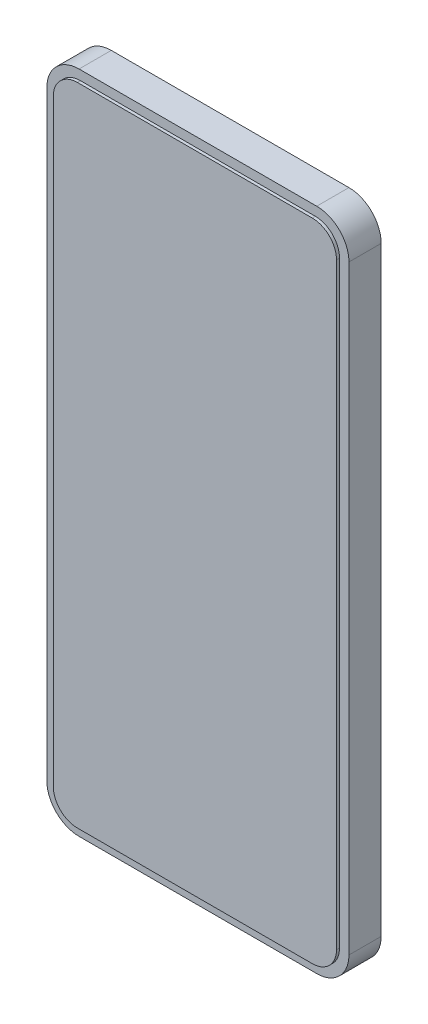
from build123d import *

# Parameters (mm, degrees)
SKETCH1_W           = 75
SKETCH1_H           = 165
BOSS_EXTRUDE1_DEPTH = 8
FILLET1_R           = 8
SKETCH2_W           = 22
SKETCH2_H           = 35
BOSS_EXTRUDE2_DEPTH = 1
FILLET2_R           = 6
SKETCH3_R           = 5
SKETCH3_R_2         = 4
SKETCH3_R_3         = 1.859320818
CUT_EXTRUDE1_DEPTH  = 0.5
SKETCH4_W           = 70.313708498
SKETCH4_H           = 160.313708498
BOSS_EXTRUDE3_DEPTH = 0.75
FILLET3_R           = 6


with BuildPart() as part:
    # Sketch1 → Boss-Extrude1 (new body)
    with BuildSketch(Plane.XY):
        Rectangle(SKETCH1_W, SKETCH1_H)
    extrude(amount=BOSS_EXTRUDE1_DEPTH)

    # Fillet1
    fillet1_edges = [part.edges().sort_by_distance(p)[0] for p in [
        (37.5, -82.5, 4),
        (-37.5, -82.5, 4),
        (-37.5, 82.5, 4),
        (37.5, 82.5, 4),
    ]]
    fillet(fillet1_edges, radius=FILLET1_R)

    # Sketch2 → Boss-Extrude2 (add)
    with BuildSketch(Plane(origin=(0, 0, 0), x_dir=(-1, 0, 0), z_dir=(0, 0, -1))):
        with Locations((-19.5, 58)):
            Rectangle(SKETCH2_W, SKETCH2_H)
    extrude(amount=BOSS_EXTRUDE2_DEPTH)

    # Fillet2
    fillet2_edges = [part.edges().sort_by_distance(p)[0] for p in [
        (8.5, 40.5, -0.5),
        (8.5, 75.5, -0.5),
        (30.5, 75.5, -0.5),
        (30.5, 40.5, -0.5),
    ]]
    fillet(fillet2_edges, radius=FILLET2_R)

    # Sketch3 → Cut-Extrude1 (cut)
    with BuildSketch(Plane(origin=(0, 0, -1), x_dir=(-1, 0, 0), z_dir=(0, 0, -1))):
        with Locations((-23.043680303, 68)):
            Circle(SKETCH3_R)
        with Locations((-23.043680303, 57)):
            Circle(SKETCH3_R_2)
        with Locations((-23.043680303, 47)):
            Circle(SKETCH3_R_2)
        with Locations((-13.043680303, 68)):
            Circle(SKETCH3_R_3)
    extrude(amount=-CUT_EXTRUDE1_DEPTH, mode=Mode.SUBTRACT)

    # Sketch4 → Boss-Extrude3 (add)
    with BuildSketch(Plane.XY.offset(8)):
        Rectangle(SKETCH4_W, SKETCH4_H)
    extrude(amount=BOSS_EXTRUDE3_DEPTH)

    # Fillet3
    fillet3_edges = [part.edges().sort_by_distance(p)[0] for p in [
        (-35.156854249, 80.156854249, 8.375),
        (-35.156854249, -80.156854249, 8.375),
        (35.156854249, -80.156854249, 8.375),
        (35.156854249, 80.156854249, 8.375),
    ]]
    fillet(fillet3_edges, radius=FILLET3_R)


solid = part.part
